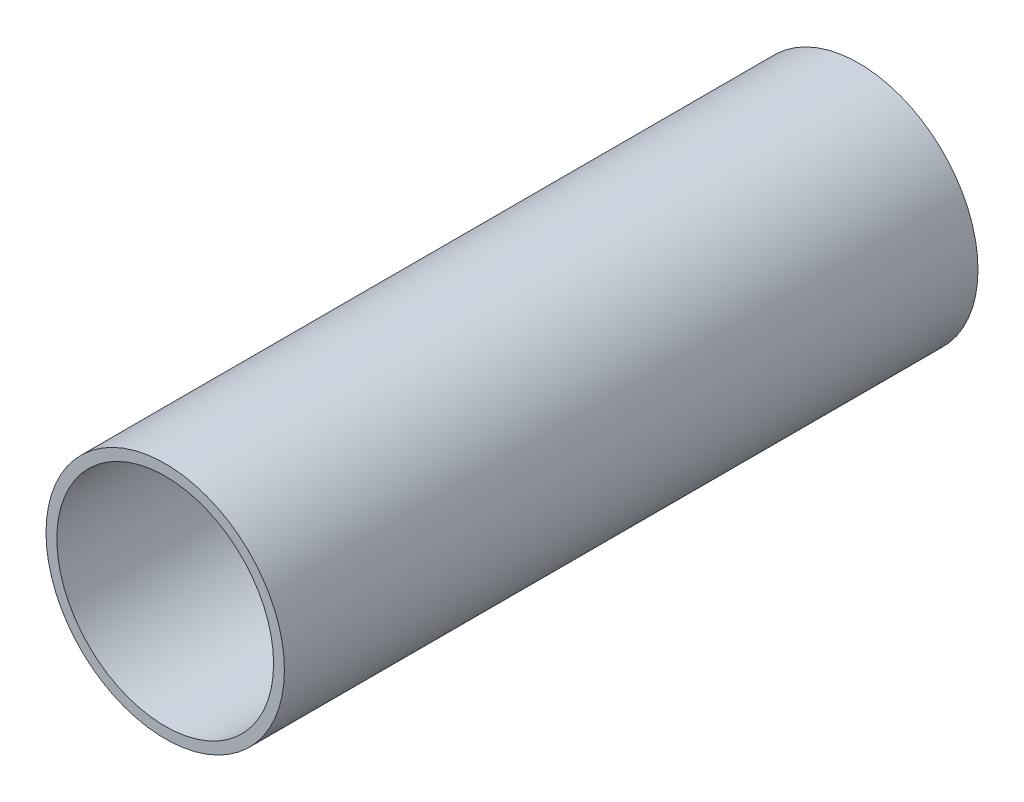
from build123d import *

# Parameters (mm, degrees)
SKETCH1_R           = 17.4625
SKETCH1_R_2         = 15.875
BOSS_EXTRUDE1_DEPTH = 101.6


with BuildPart() as part:
    # Sketch1 → Boss-Extrude1 (new body)
    with BuildSketch(Plane.XY):
        Circle(SKETCH1_R)
        Circle(SKETCH1_R_2, mode=Mode.SUBTRACT)
    extrude(amount=BOSS_EXTRUDE1_DEPTH)


solid = part.part
